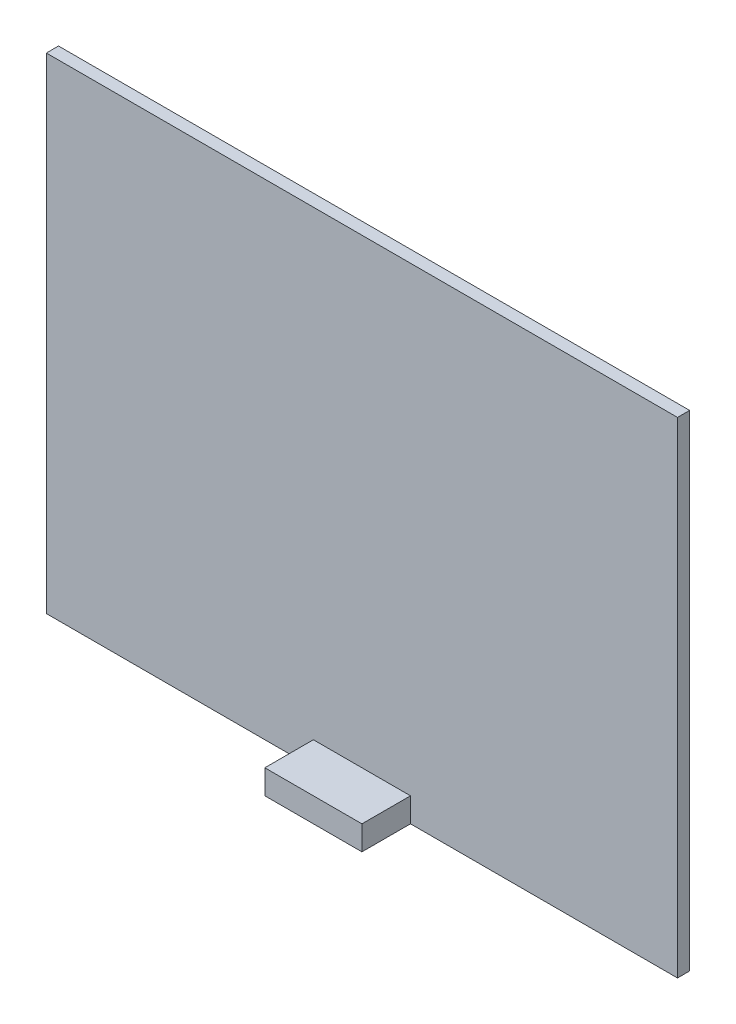
from build123d import *

# Parameters (mm, degrees)
SKETCH1_W           = 300
SKETCH1_H           = 200
BOSS_EXTRUDE1_DEPTH = 5
SKETCH3_W           = 20
SKETCH3_H           = 20
SKETCH3_H_2         = 40
CUT_EXTRUDE1_DEPTH  = 5
SKETCH4_W           = 20
SKETCH4_H           = 140
CUT_EXTRUDE2_DEPTH  = 10
SKETCH6_W           = 40
SKETCH6_H           = 25
BOSS_EXTRUDE3_DEPTH = 10


with BuildPart() as part:
    # Sketch1 → Boss-Extrude1 (new body)
    with BuildSketch(Plane.XY):
        Rectangle(SKETCH1_W, SKETCH1_H)
    extrude(amount=BOSS_EXTRUDE1_DEPTH)

    # Sketch3 → Cut-Extrude1 (cut)
    with BuildSketch(Plane.XY.offset(5)):
        with Locations((-140, -90)):
            Rectangle(SKETCH3_W, SKETCH3_H)
        with Locations((-140, 80)):
            Rectangle(SKETCH3_W, SKETCH3_H_2)
        with Locations((140, 80)):
            Rectangle(SKETCH3_W, SKETCH3_H_2)
        with Locations((140, -90)):
            Rectangle(SKETCH3_W, SKETCH3_H)
    extrude(amount=-CUT_EXTRUDE1_DEPTH, mode=Mode.SUBTRACT)

    # Sketch4 → Cut-Extrude2 (cut)
    with BuildSketch(Plane.XY.offset(5)):
        with Locations((-140, -10)):
            Rectangle(SKETCH4_W, SKETCH4_H)
        with Locations((140, -10)):
            Rectangle(SKETCH4_W, SKETCH4_H)
    extrude(amount=-CUT_EXTRUDE2_DEPTH, mode=Mode.SUBTRACT)

    # Sketch6 → Boss-Extrude3 (add)
    with BuildSketch(Plane.XZ.offset(100)):
        with Locations((0, 12.5)):
            Rectangle(SKETCH6_W, SKETCH6_H)
    extrude(amount=-BOSS_EXTRUDE3_DEPTH)


solid = part.part
